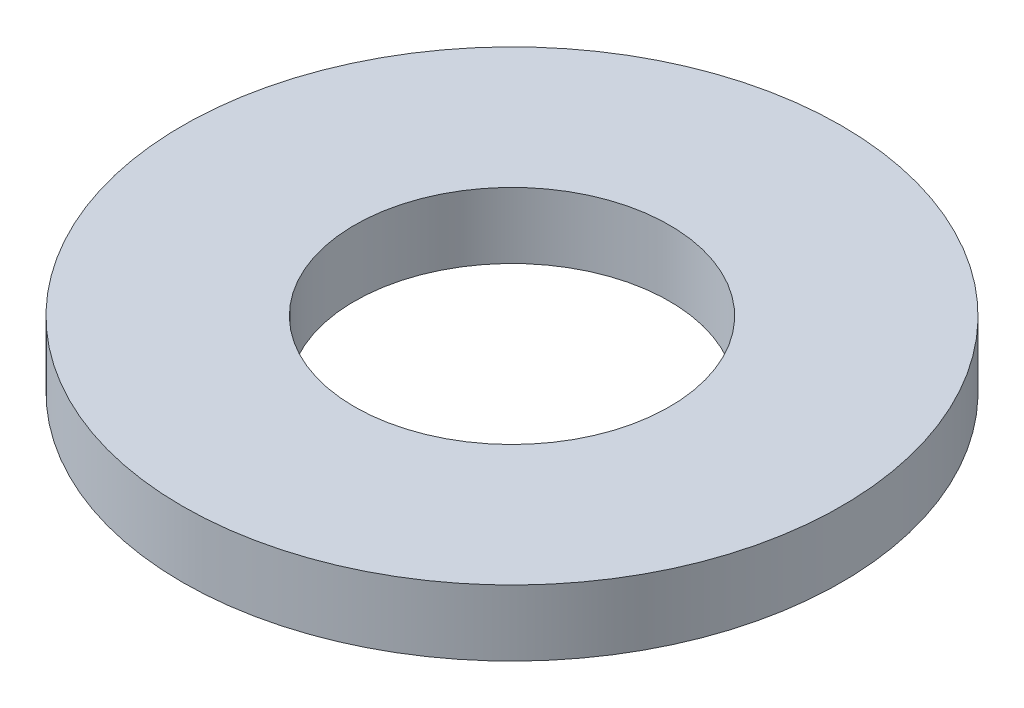
from build123d import *

# Parameters (mm, degrees)
SKETCH1_R           = 4.5
SKETCH1_R_2         = 2.15
BOSS_EXTRUDE1_DEPTH = 0.9


with BuildPart() as part:
    # Sketch1 → Boss-Extrude1 (new body)
    with BuildSketch(Plane(origin=(0, 0, 0), x_dir=(1, 0, 0), z_dir=(0, 1, 0))):
        with Locations(Location((0, 0, 0), (0, 0, 270))):
            Circle(SKETCH1_R)
        with Locations(Location((0, 0, 0), (0, 0, 270))):
            Circle(SKETCH1_R_2, mode=Mode.SUBTRACT)
    extrude(amount=BOSS_EXTRUDE1_DEPTH)


solid = part.part
